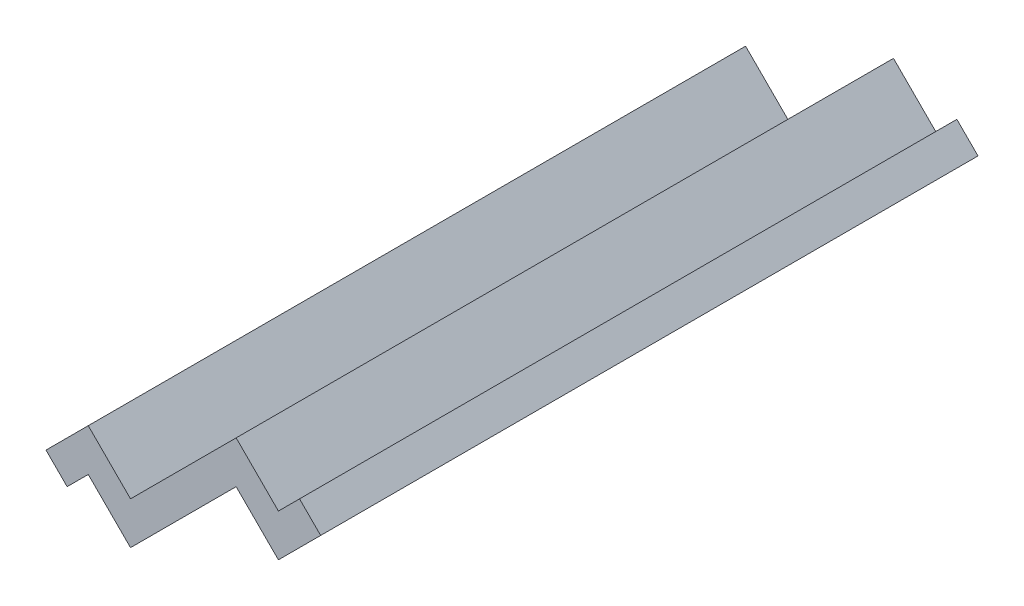
from build123d import *

# Parameters (mm, degrees)
EXTRUDE_1_DEPTH = 220


with BuildPart() as part:
    # 草图1 → 凸台-拉伸1 (new body)
    with BuildSketch(Plane.XY):
        Polygon((0, 0), (-10.606601718, -10.606601718), (-17.67766953, -17.67766953), (-31.819805153, -3.535533906), (-38.890872965, -10.606601718), (-45.961940777, -3.535533906), (-31.819805153, 10.606601718), (-17.67766953, -3.535533906), (0, 14.142135624), (10.606601718, 24.748737342), (17.67766953, 31.819805153), (31.819805153, 17.67766953), (38.890872965, 24.748737342), (45.961940777, 17.67766953), (31.819805153, 3.535533906), (17.67766953, 17.67766953), align=None)
    extrude(amount=EXTRUDE_1_DEPTH)


solid = part.part
